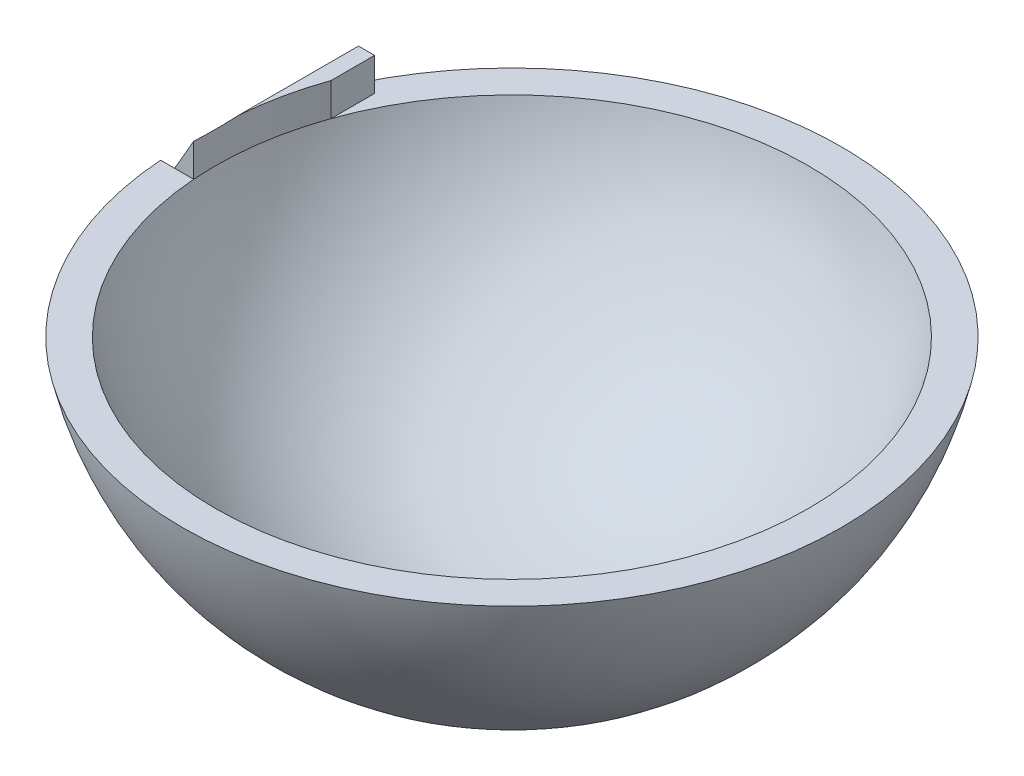
from build123d import *

# Parameters (mm, degrees)
BOSS_EXTRUDE1_DEPTH = 6.35
CUT_EXTRUDE1_DEPTH  = 33.02
CUT_EXTRUDE2_START  = -10.16
CUT_EXTRUDE2_DEPTH  = 10.16


with BuildPart() as part:
    # Sketch2 → Revolve1 (revolve)
    with BuildSketch(Plane.XY):
        with BuildLine():
            Line((63.5, 0), (57.15, 0))
            ThreePointArc((57.15, 0), (36.252554785, -32.143295216), (0, -44.61914851))
            Line((0, -44.61914851), (0, -50.8))
            Line((0, -50.8), (0, -50.947674419))
            ThreePointArc((0, -50.947674419), (40.70600548, -36.636394765), (63.5, 0))
        make_face()
    revolve(axis=Axis((0, 0, 0), (0, -1, 0)))

    # Sketch5 → Boss-Extrude1 (add)
    with BuildSketch(Plane(origin=(0, 0, 0), x_dir=(1, 0, 0), z_dir=(0, 1, 0))):
        with BuildLine():
            ThreePointArc((-56.986642084, -4.318), (-56.652044307, 7.52784005), (-53.881536726, 19.05))
            Line((-53.881536726, 19.05), (-53.881536726, 27.432))
            Line((-53.881536726, 27.432), (-57.268973939, 27.432))
            ThreePointArc((-57.268973939, 27.432), (-61.408309513, 16.163833787), (-63.353017892, 4.318))
            Line((-63.353017892, 4.318), (-63.353017892, -4.318))
            Line((-63.353017892, -4.318), (-56.986642084, -4.318))
        make_face()
    extrude(amount=BOSS_EXTRUDE1_DEPTH)

    # Sketch6 → Cut-Extrude1 (cut)
    with BuildSketch(Plane.XY.offset(4.318)):
        Polygon((-60.652816293, 0), (-56.986642084, 6.35), (-63.353017892, 6.35), (-63.353017892, 0), align=None)
    extrude(amount=-CUT_EXTRUDE1_DEPTH, mode=Mode.SUBTRACT)

    # Sketch7 → Cut-Extrude2 (cut)
    with BuildSketch(Plane(origin=(0, 0, 0), x_dir=(1, 0, 0), z_dir=(0, 1, 0)).offset(CUT_EXTRUDE2_START)):
        with BuildLine():
            Line((-63.353017892, -4.318), (-60.652816293, -4.318))
            Line((-60.652816293, -4.318), (-60.652816293, 18.801220059))
            ThreePointArc((-60.652816293, 18.801220059), (-63.071279613, 7.366389074), (-63.353017892, -4.318))
        make_face()
    extrude(amount=CUT_EXTRUDE2_DEPTH, mode=Mode.SUBTRACT)


solid = part.part
